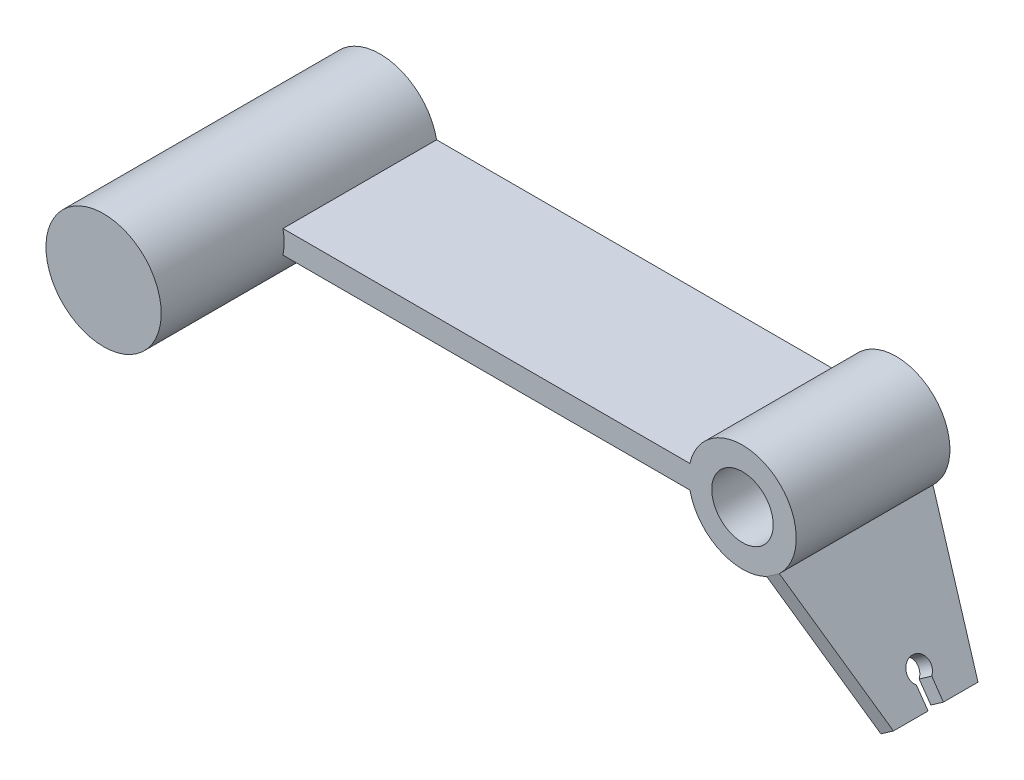
from build123d import *

# Parameters (mm, degrees)
SKETCH2_R                = 4
BOSS_EXTRUDE1_DEPTH      = 20
BOSS_EXTRUDE2_DEPTH      = 16
BOSS_EXTRUDE2_DEPTH_BACK = 20
SKETCH3_R                = 7.5
BOSS_EXTRUDE3_START      = -20
BOSS_EXTRUDE3_DEPTH      = 20
CUT_EXTRUDE1_DEPTH       = 2
CUT_EXTRUDE2_REACH       = 88.378
BOSS_EXTRUDE4_DEPTH      = 2


with BuildPart() as part:
    # Sketch2 → Boss-Extrude1 (new body)
    with BuildSketch(Plane.XY):
        with BuildLine():
            Line((-67.162602834, 1.5), (-6.837397166, 1.5))
            ThreePointArc((-6.837397166, 1.5), (7, 0), (-6.837397166, -1.5))
            Line((-6.837397166, -1.5), (-67.162602834, -1.5))
            Line((-67.162602834, -1.5), (-67.162602834, 1.5))
        make_face()
        Circle(SKETCH2_R, mode=Mode.SUBTRACT)
    extrude(amount=BOSS_EXTRUDE1_DEPTH)

    # Sketch3 → Boss-Extrude2 (add, two sides: drawn at the far end of the back side and taken through both)
    with BuildSketch(Plane.XY.offset(20).offset(-BOSS_EXTRUDE2_DEPTH_BACK)):
        with Locations(Location((-67.162602834, 0, 0), (0, 0, 348.463040967))):
            Circle(SKETCH3_R)
    extrude(amount=BOSS_EXTRUDE2_DEPTH + BOSS_EXTRUDE2_DEPTH_BACK)

    # Sketch4 → Boss-Extrude3 (add)
    with BuildSketch(Plane.XY.offset(20).offset(BOSS_EXTRUDE3_START)):
        with BuildLine():
            Line((15.158562953, -19.905224671), (13.520258864, -21.052377544))
            Line((13.520258864, -21.052377544), (3.154702075, -6.248828276))
            ThreePointArc((3.154702075, -6.248828276), (4.015035054, -5.73406431), (4.793006163, -5.101675403))
            Line((4.793006163, -5.101675403), (15.158562953, -19.905224671))
        make_face()
    extrude(amount=BOSS_EXTRUDE3_DEPTH)

    # Sketch5 → Cut-Extrude1 (cut)
    with BuildSketch(Plane(origin=(0.8191520442889967, 0.5735764363510467, 0), x_dir=(0, 0, -1), z_dir=(0.8191520442889931, 0.5735764363510442, 0))):
        with BuildLine():
            Line((-11, -22.346237219), (-11, -25))
            Line((-11, -25), (-9, -25))
            Line((-9, -25), (-9, -22.346237219))
            ThreePointArc((-9, -22.346237219), (-10, -19.72820323), (-11, -22.346237219))
        make_face()
    extrude(amount=-CUT_EXTRUDE1_DEPTH, mode=Mode.SUBTRACT)

    # Sketch6 → Cut-Extrude2 (cut, up to next)
    with BuildSketch(Plane(origin=(0.8191520442889967, 0.5735764363510467, 0), x_dir=(0, 0, -1), z_dir=(0.8191520442889931, 0.5735764363510442, 0)), mode=Mode.PRIVATE) as cut_extrude2_sk1:
        Polygon((-20, -6.92820323), (-15.5, -25), (-21.37977423, -25), (-21.37977423, -6.621098629), align=None)
    cut_extrude2_tool1 = extrude(cut_extrude2_sk1.sketch, amount=-CUT_EXTRUDE2_REACH, mode=Mode.PRIVATE) & part.part
    # Sketch6 → Cut-Extrude2 (cut, up to next)
    with BuildSketch(Plane(origin=(0.8191520442889967, 0.5735764363510467, 0), x_dir=(0, 0, -1), z_dir=(0.8191520442889931, 0.5735764363510442, 0)), mode=Mode.PRIVATE) as cut_extrude2_sk2:
        Polygon((0, -6.92820323), (1.41409792, -6.92820323), (1.41409792, -25), (-4.5, -25), align=None)
    cut_extrude2_tool2 = extrude(cut_extrude2_sk2.sketch, amount=-CUT_EXTRUDE2_REACH, mode=Mode.PRIVATE) & part.part
    add(cut_extrude2_tool1.solids().sort_by_distance((11.026351, -14.003814, 19.337545))[0], mode=Mode.SUBTRACT)
    add(cut_extrude2_tool2.solids().sort_by_distance((11.036642, -14.018511, 0.648226))[0], mode=Mode.SUBTRACT)

    # Sketch7 → Boss-Extrude4 (add)
    with BuildSketch(Plane.XY.offset(9)):
        Polygon((-25.248427633, -1.5), (8.33748047, -13.65060291), (3.154702075, -6.248828276), (-6.837397166, -1.5), align=None)
    extrude(amount=BOSS_EXTRUDE4_DEPTH)


solid = part.part
